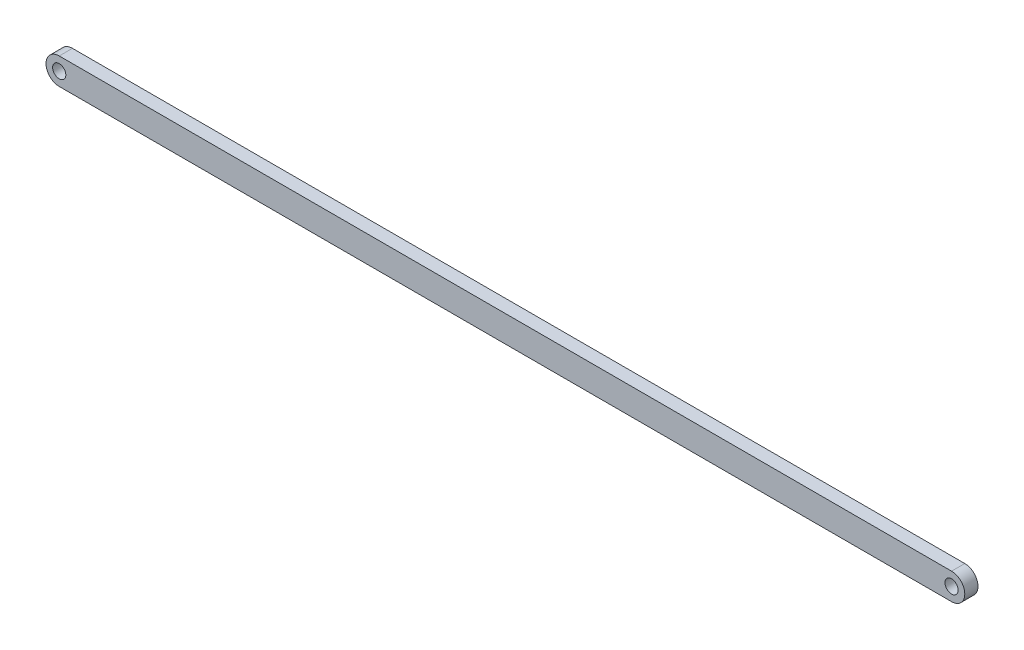
from build123d import *

# Parameters (mm, degrees)
ESBO_O1_R                = 2.5
RESSALTO_EXTRUS_O1_DEPTH = 5


with BuildPart() as part:
    # Esboço1 → Ressalto-extrusão1 (new body)
    with BuildSketch(Plane.XY):
        with BuildLine():
            Line((-168.72, 5), (168.72, 5))
            ThreePointArc((168.72, 5), (173.72, 0), (168.72, -5))
            Line((168.72, -5), (-168.72, -5))
            ThreePointArc((-168.72, -5), (-173.72, 0), (-168.72, 5))
        make_face()
        with Locations((-168.72, 0)):
            Circle(ESBO_O1_R, mode=Mode.SUBTRACT)
        with Locations((168.72, 0)):
            Circle(ESBO_O1_R, mode=Mode.SUBTRACT)
    extrude(amount=RESSALTO_EXTRUS_O1_DEPTH)


solid = part.part
